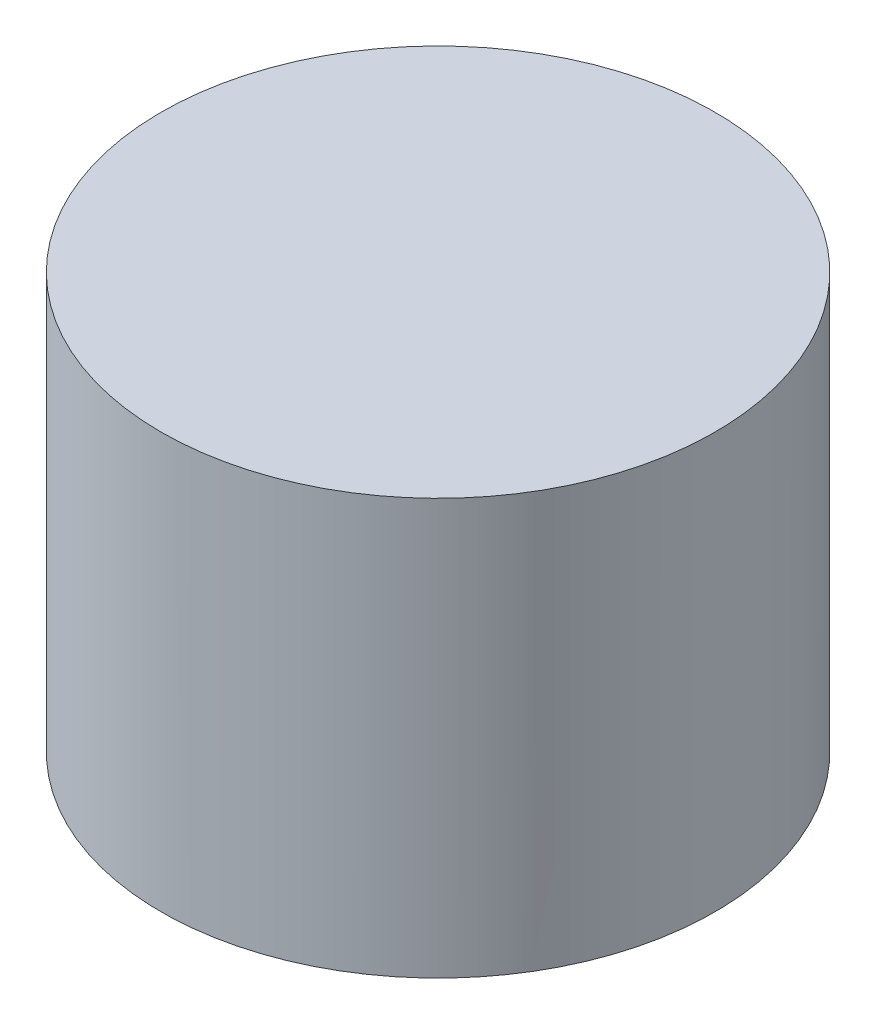
from build123d import *

# Parameters (mm, degrees)
SKETCH1_R           = 20
BOSS_EXTRUDE1_DEPTH = 10
CUT_EXTRUDE2_DEPTH  = 5
SKETCH5_R           = 20
BOSS_EXTRUDE3_DEPTH = 15
SKETCH6_R           = 20
BOSS_EXTRUDE4_DEPTH = 5
SKETCH7_R           = 7.5
CUT_EXTRUDE3_DEPTH  = 15
CUT_EXTRUDE4_DEPTH  = 42.231056256


with BuildPart() as part:
    # Sketch1 → Boss-Extrude1 (new body)
    with BuildSketch(Plane(origin=(0, 0, 0), x_dir=(1, 0, 0), z_dir=(0, 1, 0))):
        with Locations(Location((0, 0, 0), (0, 0, 270))):
            Circle(SKETCH1_R)
    extrude(amount=BOSS_EXTRUDE1_DEPTH)

    # Sketch2 → Cut-Extrude2 (cut)
    with BuildSketch(Plane(origin=(0, 10, 0), x_dir=(1, 0, 0), z_dir=(0, 1, 0))):
        Polygon((10.04843053, -5.688794004), (9.950855389, 5.857799105), (-0.097575141, 11.546593109), (-10.04843053, 5.688794004), (-9.950855389, -5.857799105), (0.097575141, -11.546593109), align=None)
    extrude(amount=-CUT_EXTRUDE2_DEPTH, mode=Mode.SUBTRACT)

    # Sketch5 → Boss-Extrude3 (add)
    with BuildSketch(Plane(origin=(0, 10, 0), x_dir=(1, 0, 0), z_dir=(0, 1, 0))):
        with Locations(Location((0, 0, 0), (0, 0, 270))):
            Circle(SKETCH5_R)
        Polygon((-9.950855389, -5.857799105), (0.097575141, -11.546593109), (10.04843053, -5.688794004), (9.950855389, 5.857799105), (-0.097575141, 11.546593109), (-10.04843053, 5.688794004), align=None, mode=Mode.SUBTRACT)
    extrude(amount=BOSS_EXTRUDE3_DEPTH)

    # Sketch6 → Boss-Extrude4 (add)
    with BuildSketch(Plane(origin=(0, 25, 0), x_dir=(1, 0, 0), z_dir=(0, 1, 0))):
        with Locations(Location((0, 0, 0), (0, 0, 270))):
            Circle(SKETCH6_R)
    extrude(amount=BOSS_EXTRUDE4_DEPTH)

    # Sketch7 → Cut-Extrude3 (cut)
    with BuildSketch(Plane.XZ):
        with Locations(Location((0, 0, 0), (0, 0, 270))):
            Circle(SKETCH7_R)
    extrude(amount=-CUT_EXTRUDE3_DEPTH, mode=Mode.SUBTRACT)

    # Sketch8 → Cut-Extrude4 (cut, through all)
    with BuildSketch(Plane.XY):
        Polygon((-6.5, 15), (-6.5, 0), (6.5, 0), (6.5, 15), (12.5, 15), (12.5, 25), (-12.5, 25), (-12.5, 15), align=None)
    extrude(amount=-CUT_EXTRUDE4_DEPTH, mode=Mode.SUBTRACT)


solid = part.part
